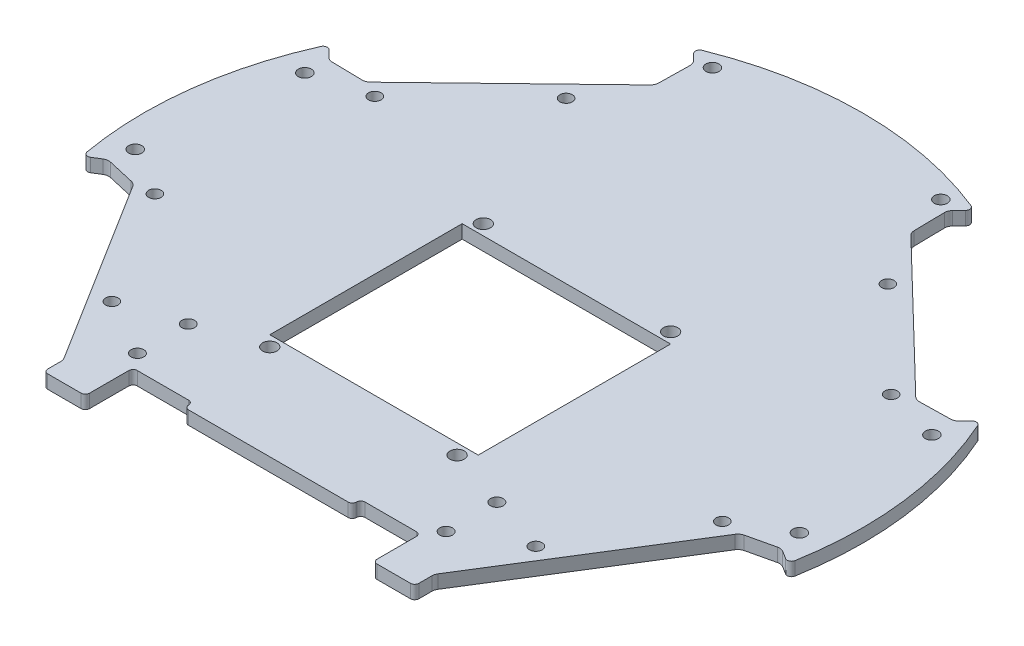
from build123d import *

# Parameters (mm, degrees)
BOSS_EXTRUDE4_DEPTH  = 1.5875
M3_CLEARANCE_HOLE3_D = 3
M3_CLEARANCE_HOLE1_D = 3.1
M3_CLEARANCE_HOLE4_D = 2.95
M3_CLEARANCE_HOLE2_D = 3.1
BOSS_EXTRUDE6_DEPTH  = 3.175
FILLET1_R            = 2
FILLET3_R            = 1
M3_CLEARANCE_HOLE5_D = 3.4
SKETCH27_W           = 49.3
SKETCH27_H           = 45.5
CUT_EXTRUDE5_DEPTH   = 10


with BuildPart() as part:
    # Sketch1 → Boss-Extrude4 (new, symmetric)
    with BuildSketch(Plane(origin=(0, 0, 0), x_dir=(1, 0, 0), z_dir=(0, 1, 0))):
        with BuildLine():
            Line((-62.799553621, 32.496136604), (-73.969425011, 32.691107434))
            Line((-73.969425011, 32.691107434), (-77.053684287, 35.88495141))
            ThreePointArc((-77.053684287, 35.88495141), (-84.36642289, 10.358894189), (-83.446216027, -16.178041625))
            Line((-83.446216027, -16.178041625), (-79.680911643, -13.825218315))
            Line((-79.680911643, -13.825218315), (-69.484649137, -16.179210996))
            Line((-69.484649137, -16.179210996), (-43.894490772, -57.132025032))
            Line((-43.894490772, -57.132025032), (-43.894490772, -64.826600275))
            Line((-43.894490772, -64.826600275), (-43.094490772, -64.826600275))
            Line((-43.094490772, -64.826600275), (-34, -64.826600275))
            Line((-34, -64.826600275), (-34, -55.55))
            Line((-34, -55.55), (-34, -53.55))
            Line((-34, -53.55), (-20, -53.55))
            Line((-20, -53.55), (-19.718918331, -55.55))
            Line((-19.718918331, -55.55), (19.718918331, -55.55))
            Line((19.718918331, -55.55), (20, -53.55))
            Line((20, -53.55), (34, -53.55))
            Line((34, -53.55), (34, -55.55))
            Line((34, -55.55), (34, -64.826600275))
            Line((34, -64.826600275), (43.094490772, -64.826600275))
            Line((43.094490772, -64.826600275), (43.894490772, -64.826600275))
            Line((43.894490772, -64.826600275), (43.894490772, -57.132025032))
            Line((43.894490772, -57.132025032), (69.484649137, -16.179210996))
            Line((69.484649137, -16.179210996), (79.680911643, -13.825218315))
            Line((79.680911643, -13.825218315), (83.446216027, -16.178041625))
            ThreePointArc((83.446216027, -16.178041625), (84.610662337, -8.126242604), (85, 0))
            ThreePointArc((85, 0), (82.98964744, 18.377116688), (77.053684287, 35.88495141))
            Line((77.053684287, 35.88495141), (73.969425011, 32.691107434))
            Line((73.969425011, 32.691107434), (62.799553621, 32.496136604))
            Line((62.799553621, 32.496136604), (30.284668021, 63.895396642))
            Line((30.284668021, 63.895396642), (30.089697191, 75.065268032))
            Line((30.089697191, 75.065268032), (33.173956467, 78.259112008))
            ThreePointArc((33.173956467, 78.259112008), (0, 85), (-33.173956467, 78.259112008))
            Line((-33.173956467, 78.259112008), (-30.089697191, 75.065268032))
            Line((-30.089697191, 75.065268032), (-30.284668021, 63.895396642))
            Line((-30.284668021, 63.895396642), (-62.799553621, 32.496136604))
        make_face()
    extrude(amount=BOSS_EXTRUDE4_DEPTH, both=True)

    # M3 Clearance Hole3 (through all)
    with Locations(Plane(origin=(0, -1.5875, 0), x_dir=(-1, 0, 0), z_dir=(0, -1, 0))):
        with Locations((36.5, -50), (36.5, -38), (-36.5, -50), (-36.5, -38)):
            Hole(M3_CLEARANCE_HOLE3_D / 2)

    # M3 Clearance Hole1 (through all)
    with Locations(Plane(origin=(0, 1.5875, 0), x_dir=(1, 0, 0), z_dir=(0, 1, 0))):
        with Locations((-78.542321426, -8.49139241), (78.542321426, -8.49139241), (74.155025063, 27.240269049), (-74.155025063, 27.240269049)):
            Hole(M3_CLEARANCE_HOLE1_D / 2)

    # M3 Clearance Hole4 (through all)
    with Locations(Plane(origin=(0, -1.5875, 0), x_dir=(-1, 0, 0), z_dir=(0, -1, 0))):
        with Locations((-67.099301622, -15.278865202), (-50.141885166, -42.416404279), (-61.062544382, 30.698137949), (-38.043670771, 52.927205804), (50.141885166, -42.416404279), (67.099301622, -15.278865202), (38.043670771, 52.927205804), (61.062544382, 30.698137949)):
            Hole(M3_CLEARANCE_HOLE4_D / 2)

    # M3 Clearance Hole2 (through all)
    with Locations(Plane(origin=(0, 1.5875, 0), x_dir=(1, 0, 0), z_dir=(0, 1, 0))):
        with Locations((27, 76.497766718), (-27, 76.497766718)):
            Hole(M3_CLEARANCE_HOLE2_D / 2)

    # Sketch22 → Boss-Extrude6 (add)
    with BuildSketch(Plane(origin=(0, 1.5875, 0), x_dir=(1, 0, 0), z_dir=(0, 1, 0))):
        Polygon((65.061950694, 32.535626892), (30.245177733, 66.157793715), (30.284668021, 63.895396642), (62.799553621, 32.496136604), align=None)
        Polygon((-30.284668021, 63.895396642), (-30.245177733, 66.157793715), (-65.061950694, 32.535626892), (-62.799553621, 32.496136604), align=None)
        Polygon((43.894490772, -60.151352895), (71.689396914, -15.670204865), (69.484649137, -16.179210996), (43.894490772, -57.132025032), align=None)
        Polygon((-69.484649137, -16.179210996), (-71.689396914, -15.670204865), (-43.894490772, -60.151352895), (-43.894490772, -57.132025032), align=None)
    extrude(amount=-BOSS_EXTRUDE6_DEPTH)

    # Fillet1
    fillet1_edges = [part.edges().sort_by_distance(p)[0] for p in [
        (-30.245177733, -0.79375, -66.157793715),
        (-65.061950694, -0.79375, -32.535626892),
        (-71.689396914, -0.79375, 15.670204865),
        (-43.894490772, -0.79375, 60.151352895),
        (43.894490772, 0.79375, 60.151352895),
        (71.689396914, 0.79375, 15.670204865),
        (65.061950694, -0.79375, -32.535626892),
        (30.245177733, 0.79375, -66.157793715),
        (30.089697191, -0.79375, -75.065268032),
        (73.969425011, -0.79375, -32.691107434),
        (79.680911643, -0.79375, 13.825218315),
        (-79.680911643, -0.79375, 13.825218315),
        (-73.969425011, -0.79375, -32.691107434),
        (-30.089697191, -0.79375, -75.065268032),
    ]]
    fillet(fillet1_edges, radius=FILLET1_R)

    # Fillet3
    fillet3_edges = [part.edges().sort_by_distance(p)[0] for p in [
        (33.173956467, -0.79375, -78.259112008),
        (77.053684287, 0.79375, -35.88495141),
        (83.446216027, -0.79375, 16.178041625),
        (43.894490772, -0.79375, 64.826600275),
        (34, 0.79375, 64.826600275),
        (34, -0.79375, 53.55),
        (20, -0.79375, 53.55),
        (19.718918331, 0.79375, 55.55),
        (-19.718918331, 0.79375, 55.55),
        (-20, -0.79375, 53.55),
        (-34, -0.79375, 53.55),
        (-34, 0.79375, 64.826600275),
        (-43.894490772, -0.79375, 64.826600275),
        (-83.446216027, -0.79375, 16.178041625),
        (-77.053684287, -0.79375, -35.88495141),
        (-33.173956467, -0.79375, -78.259112008),
    ]]
    fillet(fillet3_edges, radius=FILLET3_R)

    # M3 Clearance Hole5 (through all)
    with Locations(Plane(origin=(0, 1.5875, 0), x_dir=(1, 0, 0), z_dir=(0, 1, 0))):
        with Locations((-22.15, 17.45), (-22.15, -33.05), (22.15, -33.05), (22.15, 17.45)):
            Hole(M3_CLEARANCE_HOLE5_D / 2)

    # Sketch27 → Cut-Extrude5 (cut)
    with BuildSketch(Plane(origin=(0, 1.5875, 0), x_dir=(1, 0, 0), z_dir=(0, 1, 0))):
        with Locations((0, -7.8)):
            Rectangle(SKETCH27_W, SKETCH27_H)
    extrude(amount=-CUT_EXTRUDE5_DEPTH, mode=Mode.SUBTRACT)


solid = part.part
